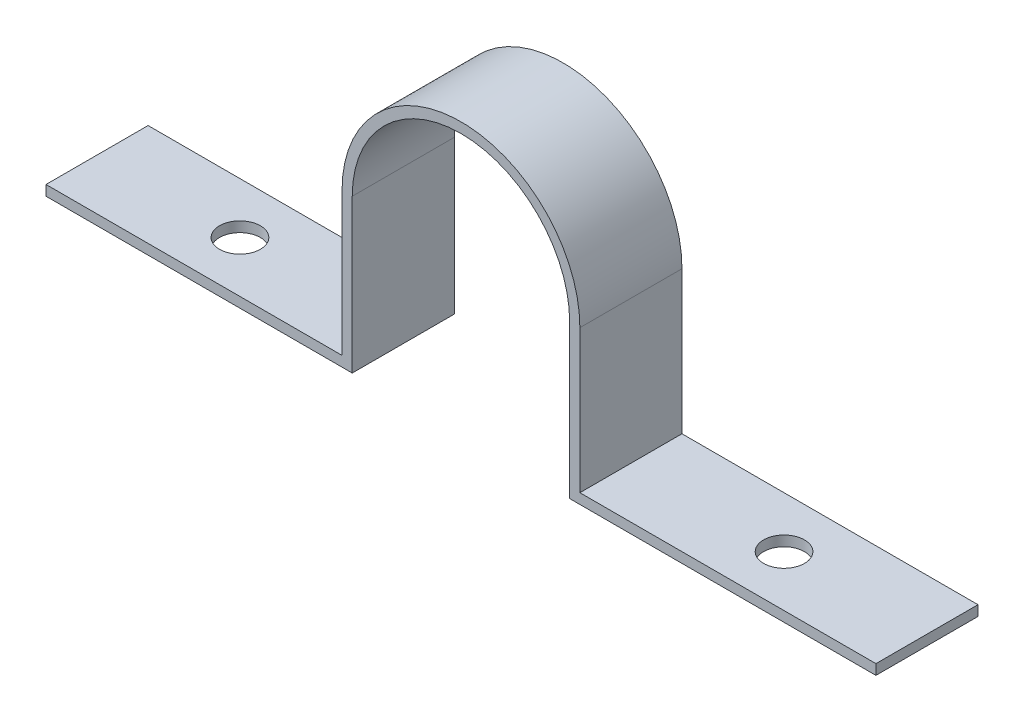
from build123d import *

# Parameters (mm, degrees)
SALIENTE_EXTRUIR1_DEPTH = 10
CROQUIS2_R              = 2
CORTAR_EXTRUIR1_DEPTH   = 10


with BuildPart() as part:
    # Croquis1 → Saliente-Extruir1 (new body)
    with BuildSketch(Plane.XY):
        with BuildLine():
            Line((10.65, 0), (10.65, -15))
            Line((10.65, -15), (40.65, -15))
            Line((40.65, -15), (40.65, -14))
            Line((40.65, -14), (39.65, -14))
            Line((39.65, -14), (11.65, -14))
            Line((11.65, -14), (11.65, 0))
            ThreePointArc((11.65, 0), (0, 11.65), (-11.65, 0))
            Line((-11.65, 0), (-11.65, -14))
            Line((-11.65, -14), (-39.65, -14))
            Line((-39.65, -14), (-40.65, -14))
            Line((-40.65, -14), (-40.65, -15))
            Line((-40.65, -15), (-10.65, -15))
            Line((-10.65, -15), (-10.65, 0))
            ThreePointArc((-10.65, 0), (0, 10.65), (10.65, 0))
        make_face()
    extrude(amount=SALIENTE_EXTRUIR1_DEPTH)

    # Croquis2 → Cortar-Extruir1 (cut)
    with BuildSketch(Plane(origin=(0, -16.507351352, 0), x_dir=(1, 0, 0), z_dir=(0, 1, 0))):
        with Locations(Location((-26.65, -5, 0), (0, 0, 90))):
            Circle(CROQUIS2_R)
        with Locations((26.65, -5)):
            Circle(CROQUIS2_R)
    extrude(amount=CORTAR_EXTRUIR1_DEPTH, mode=Mode.SUBTRACT)


solid = part.part
